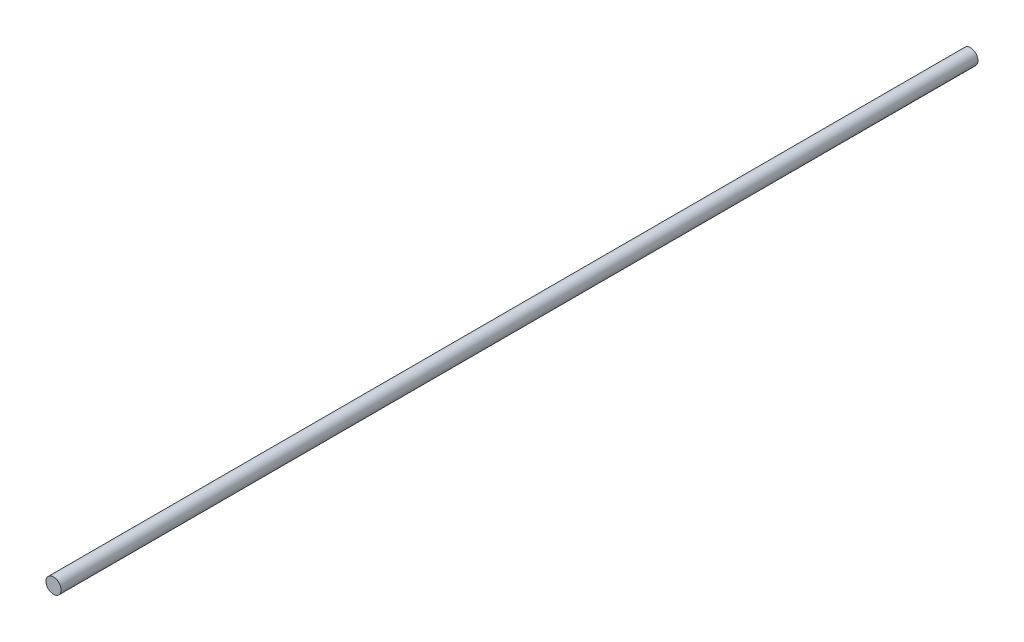
from build123d import *

# Parameters (mm, degrees)
SCHIZZO1_R                   = 1.5
ESTRUSIONE_ESTRUSIONE1_DEPTH = 182


with BuildPart() as part:
    # Schizzo1 → Estrusione-Estrusione1 (new body)
    with BuildSketch(Plane.XY):
        Circle(SCHIZZO1_R)
    extrude(amount=ESTRUSIONE_ESTRUSIONE1_DEPTH)


solid = part.part
